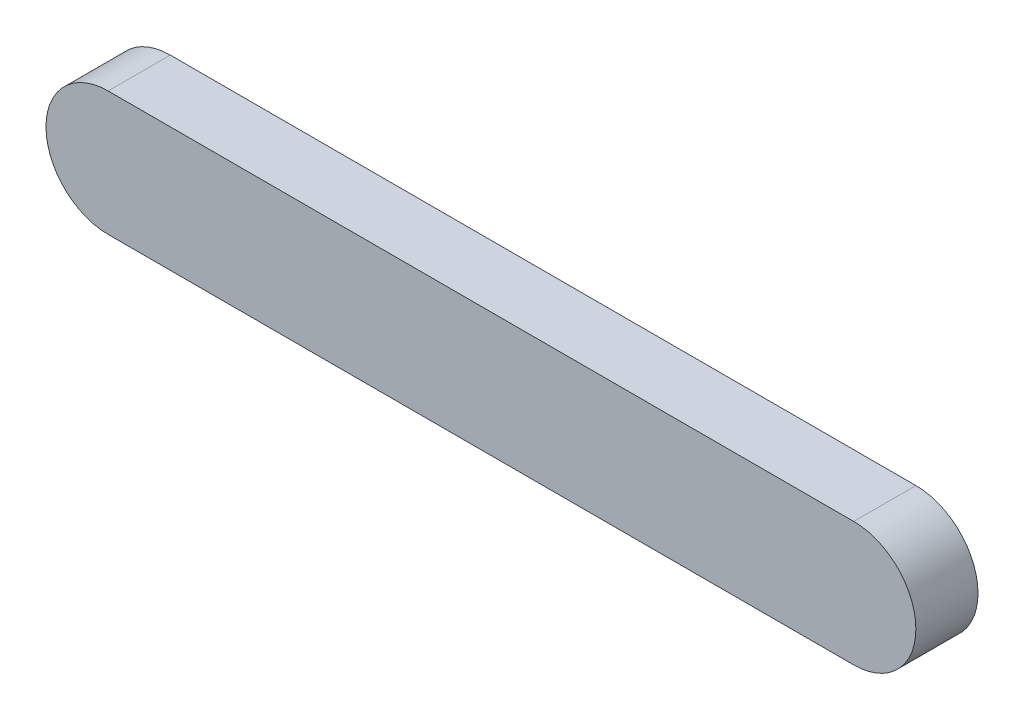
from build123d import *

# Parameters (mm, degrees)
EXTRUDE_1_DEPTH = 10


with BuildPart() as part:
    # 草图1 → 凸台-拉伸1 (new body)
    with BuildSketch(Plane.XY):
        with BuildLine():
            Line((0, 10), (120, 10))
            ThreePointArc((120, 10), (130, 0), (120, -10))
            Line((120, -10), (0, -10))
            ThreePointArc((0, -10), (-10, 0), (0, 10))
        make_face()
    extrude(amount=EXTRUDE_1_DEPTH)


solid = part.part
